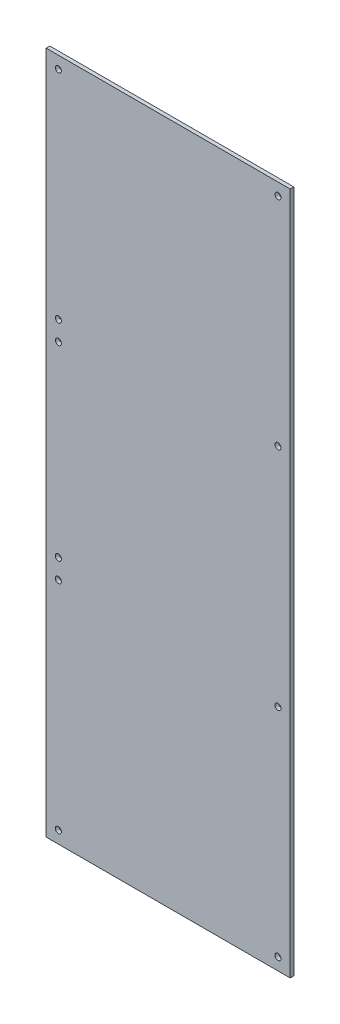
from build123d import *

# Parameters (mm, degrees)
SKETCH1_W           = 200
SKETCH1_H           = 560
BOSS_EXTRUDE1_DEPTH = 3
SKETCH2_R           = 2.5
CUT_EXTRUDE1_DEPTH  = 504.909038289


with BuildPart() as part:
    # Sketch1 → Boss-Extrude1 (new body)
    with BuildSketch(Plane.XY):
        with Locations((65.641025641, -195.897435897)):
            Rectangle(SKETCH1_W, SKETCH1_H)
    extrude(amount=BOSS_EXTRUDE1_DEPTH)

    # Sketch2 → Cut-Extrude1 (cut, through all)
    with BuildSketch(Plane.XY.offset(3)):
        with Locations((-24.358974359, 74.102564103)):
            Circle(SKETCH2_R)
        with Locations((155.641025641, 74.102564103)):
            Circle(SKETCH2_R)
        with Locations((-24.358974359, -465.897435897)):
            Circle(SKETCH2_R)
        with Locations((155.641025641, -465.897435897)):
            Circle(SKETCH2_R)
        with Locations((-24.358974359, -288.397435897)):
            Circle(SKETCH2_R)
        with Locations((-24.358974359, -103.397435897)):
            Circle(SKETCH2_R)
        with Locations((155.641025641, -103.397435897)):
            Circle(SKETCH2_R)
        with Locations((155.641025641, -288.397435897)):
            Circle(SKETCH2_R)
        with Locations((-24.358974359, -119.397435897)):
            Circle(SKETCH2_R)
        with Locations((-24.358974359, -272.397435897)):
            Circle(SKETCH2_R)
    extrude(amount=-CUT_EXTRUDE1_DEPTH, mode=Mode.SUBTRACT)


solid = part.part
